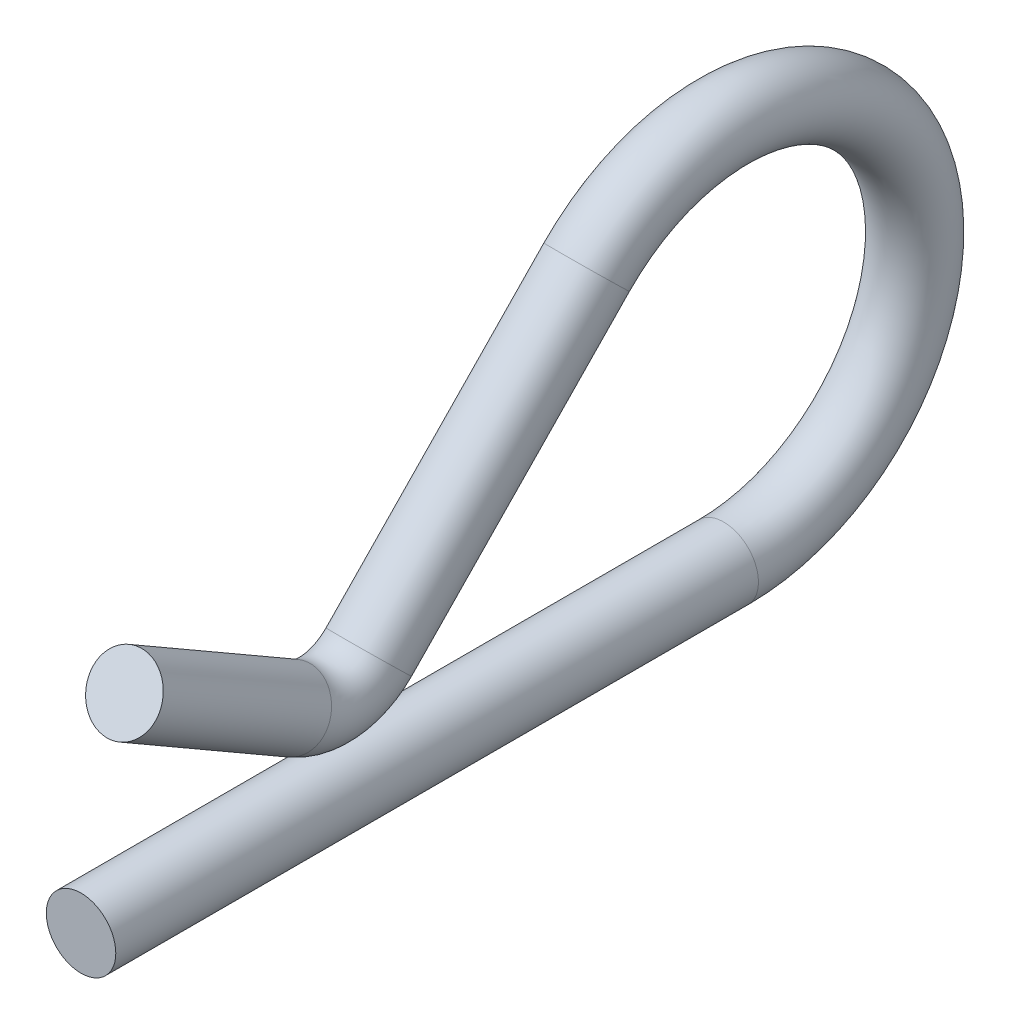
from build123d import *

# Parameters (mm, degrees)
SKETCH2_R = 1.5875


with BuildPart() as part:
    # Sweep1: sweep along a path in Sketch3
    with BuildLine(Plane(origin=(0, 0, 0), x_dir=(0, 0, -1), z_dir=(1, 0, 0))) as sweep1_path:
        Line((-27.380244867, 8.503062931), (-19.689513744, 4.065165271))
        ThreePointArc((-19.689513744, 4.065165271), (-17.868703841, 3.710303299), (-16.214197351, 4.549281246))
        Line((-16.214197351, 4.549281246), (-6.260020552, 14.802401354))
        ThreePointArc((-6.260020552, 14.802401354), (8.035840702, 12.123303187), (0, 0))
        Line((0, 0), (-29.3624, 0))
    # Sketch2 → Sweep1 (sweep)
    with BuildSketch(Plane.XY.offset(29.3624)):
        Circle(SKETCH2_R)
    sweep(path=sweep1_path.line)


solid = part.part
